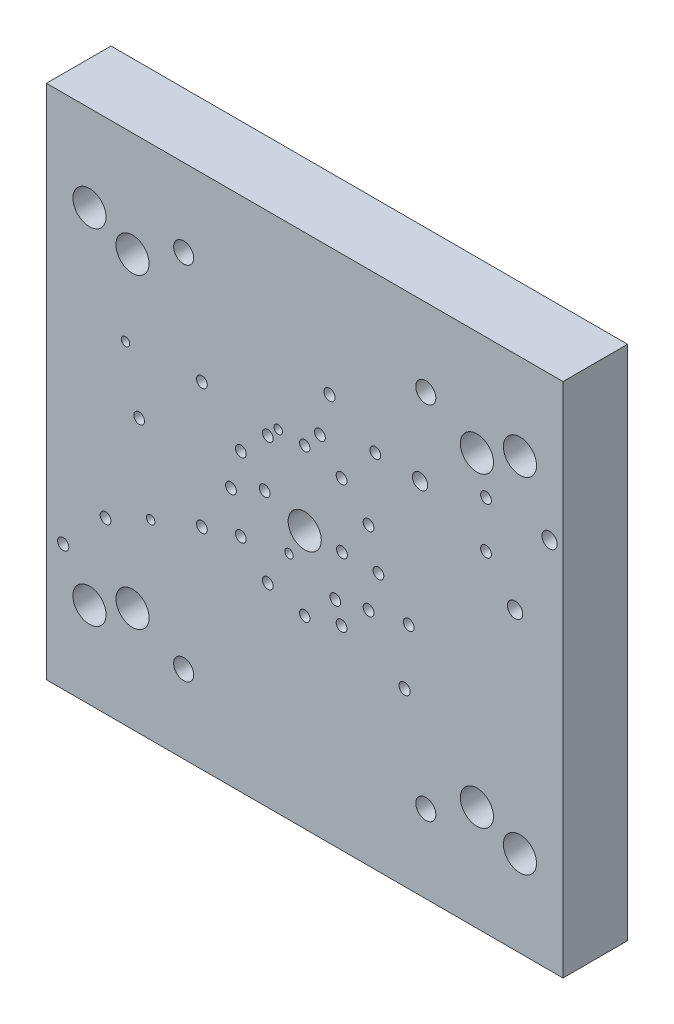
from build123d import *

# Parameters (mm, degrees)
SKETCH1_W                               = 304.8
SKETCH1_H                               = 304.8
BOSS_EXTRUDE1_DEPTH                     = 38.1
SKETCH2_R                               = 6.5151
HAAS_T_SLOT_HOLES_DEPTH                 = 219.867836833
SKETCH3_R                               = 9.779
HAAS_COUNTER_BORES_DEPTH                = 22.225
SKETCH4_R                               = 6.5151
TORMACH_T_SLOT_HOLES_DEPTH              = 219.867836833
SKETCH5_R                               = 9.779
TORMACH_COUNTER_BORES_DEPTH             = 22.225
SKETCH6_R                               = 3.0734
SPROCKET_LOCATING_HOLES_DEPTH           = 6.35
SKETCH7_R                               = 3.175
SPROCKET_MOUNTING_CLEARANCE_HOLES_DEPTH = 9.525
SKETCH8_R                               = 5.9182
F_1_2_13_TAPPED_HOLES_DEPTH             = 19.05
SKETCH9_R                               = 3.175
SKETCH9_R_2                             = 4.5
SKETCH9_R_3                             = 3.3
SKETCH9_R_4                             = 2.5
CUT_EXTRUDE1_DEPTH                      = 19.05


with BuildPart() as part:
    # Sketch1 → Boss-Extrude1 (new body)
    with BuildSketch(Plane.XY):
        Rectangle(SKETCH1_W, SKETCH1_H)
    extrude(amount=BOSS_EXTRUDE1_DEPTH)

    # Sketch2 → HAAS T-Slot Holes (cut, through all)
    with BuildSketch(Plane.XY.offset(38.1)):
        with Locations((-127, 101.6)):
            Circle(SKETCH2_R)
        with Locations((127, 101.6)):
            Circle(SKETCH2_R)
        with Locations((127, -101.6)):
            Circle(SKETCH2_R)
        with Locations((-127, -101.6)):
            Circle(SKETCH2_R)
        Circle(SKETCH2_R)
    extrude(amount=-HAAS_T_SLOT_HOLES_DEPTH, mode=Mode.SUBTRACT)

    # Sketch3 → HAAS Counter Bores (cut)
    with BuildSketch(Plane.XY.offset(38.1)):
        with Locations((-127, 101.6)):
            Circle(SKETCH3_R)
        with Locations((127, 101.6)):
            Circle(SKETCH3_R)
        Circle(SKETCH3_R)
        with Locations((127, -101.6)):
            Circle(SKETCH3_R)
        with Locations((-127, -101.6)):
            Circle(SKETCH3_R)
    extrude(amount=-HAAS_COUNTER_BORES_DEPTH, mode=Mode.SUBTRACT)

    # Sketch4 → Tormach T-Slot Holes (cut, through all)
    with BuildSketch(Plane.XY.offset(38.1)):
        with Locations((-101.6, 90.4875)):
            Circle(SKETCH4_R)
        with Locations((101.6, 90.4875)):
            Circle(SKETCH4_R)
        with Locations((-101.6, -90.4875)):
            Circle(SKETCH4_R)
        with Locations((101.6, -90.4875)):
            Circle(SKETCH4_R)
    extrude(amount=-TORMACH_T_SLOT_HOLES_DEPTH, mode=Mode.SUBTRACT)

    # Sketch5 → Tormach Counter bores (cut)
    with BuildSketch(Plane.XY.offset(38.1)):
        with Locations((-101.6, 90.4875)):
            Circle(SKETCH5_R)
        with Locations((101.6, 90.4875)):
            Circle(SKETCH5_R)
        with Locations((101.6, -90.4875)):
            Circle(SKETCH5_R)
        with Locations((-101.6, -90.4875)):
            Circle(SKETCH5_R)
    extrude(amount=-TORMACH_COUNTER_BORES_DEPTH, mode=Mode.SUBTRACT)

    # Sketch6 → Sprocket Locating Holes (cut)
    with BuildSketch(Plane.XY.offset(38.1)):
        with Locations((0, 43.50004)):
            Circle(SKETCH6_R)
        with Locations((0, -43.50004)):
            Circle(SKETCH6_R)
    extrude(amount=-SPROCKET_LOCATING_HOLES_DEPTH, mode=Mode.SUBTRACT)

    # Sketch7 → Sprocket Mounting clearance holes (cut)
    with BuildSketch(Plane.XY.offset(38.1)):
        with Locations((43.50004, 0)):
            Circle(SKETCH7_R)
        with Locations((37.672139706, -21.75002)):
            Circle(SKETCH7_R)
        with Locations((21.75002, -37.672139706)):
            Circle(SKETCH7_R)
        with Locations((-21.75002, -37.672139706)):
            Circle(SKETCH7_R)
        with Locations((-37.672139706, -21.75002)):
            Circle(SKETCH7_R)
        with Locations((-43.50004, 0)):
            Circle(SKETCH7_R)
        with Locations((-37.672139706, 21.75002)):
            Circle(SKETCH7_R)
        with Locations((-21.75002, 37.672139706)):
            Circle(SKETCH7_R)
        with Locations((21.75002, 37.672139706)):
            Circle(SKETCH7_R)
        with Locations((37.672139706, 21.75002)):
            Circle(SKETCH7_R)
    extrude(amount=-SPROCKET_MOUNTING_CLEARANCE_HOLES_DEPTH, mode=Mode.SUBTRACT)

    # Sketch8 → 1/2-13 Tapped Holes (cut)
    with BuildSketch(Plane.XY.offset(38.1)):
        with Locations((-71.4375, 106.4641)):
            Circle(SKETCH8_R)
        with Locations((71.4375, 106.4641)):
            Circle(SKETCH8_R)
        with Locations((71.4375, -106.4641)):
            Circle(SKETCH8_R)
        with Locations((-71.4375, -106.4641)):
            Circle(SKETCH8_R)
    extrude(amount=-F_1_2_13_TAPPED_HOLES_DEPTH, mode=Mode.SUBTRACT)

    # Sketch9 → Cut-Extrude1 (cut)
    with BuildSketch(Plane.XY.offset(38.1)):
        with Locations((-117.518879062, -52.287624978)):
            Circle(SKETCH9_R)
        with Locations((-60.663402782, -28.410064907)):
            Circle(SKETCH9_R)
        with Locations((-60.663402782, 45.677048092)):
            Circle(SKETCH9_R)
        with Locations((-23.619846283, 8.633491593)):
            Circle(SKETCH9_R)
        with Locations((-97.706959282, 8.633491593)):
            Circle(SKETCH9_R)
        with Locations((18.062330035, -26.179653161)):
            Circle(SKETCH9_R)
        with Locations((21.976192961, 0)):
            Circle(SKETCH9_R)
        with Locations((61.383342435, -17.37389998)):
            Circle(SKETCH9_R)
        with Locations((106.975954286, 70.395873002)):
            Circle(SKETCH9_R)
        with Locations((106.975954286, 42.900373002)):
            Circle(SKETCH9_R)
        with Locations((144.453874291, 67.437261617)):
            Circle(SKETCH9_R_2)
        with Locations((124.109154154, 21.613091073)):
            Circle(SKETCH9_R_2)
        with Locations((68.068126679, 59.327852632)):
            Circle(SKETCH9_R_2)
        with Locations((58.935264171, -51.265183733)):
            Circle(SKETCH9_R_3)
        with Locations((-142.492281823, -78.095030045)):
            Circle(SKETCH9_R_3)
        with Locations((-105.735065575, 43.771330358)):
            Circle(SKETCH9_R_4)
        with Locations((-90.897481142, -39.864168204)):
            Circle(SKETCH9_R_4)
        with Locations((-9.271096491, -16.365575471)):
            Circle(SKETCH9_R_4)
        with Locations((-15.665485897, 43.865720815)):
            Circle(SKETCH9_R_4)
        with Locations((14.626715825, 76.840475586)):
            Circle(SKETCH9_R_3)
        with Locations((8.985545702, 53.468225166)):
            Circle(SKETCH9_R)
        with Locations((41.65587457, 60.657920909)):
            Circle(SKETCH9_R)
    extrude(amount=-CUT_EXTRUDE1_DEPTH, mode=Mode.SUBTRACT)


solid = part.part
